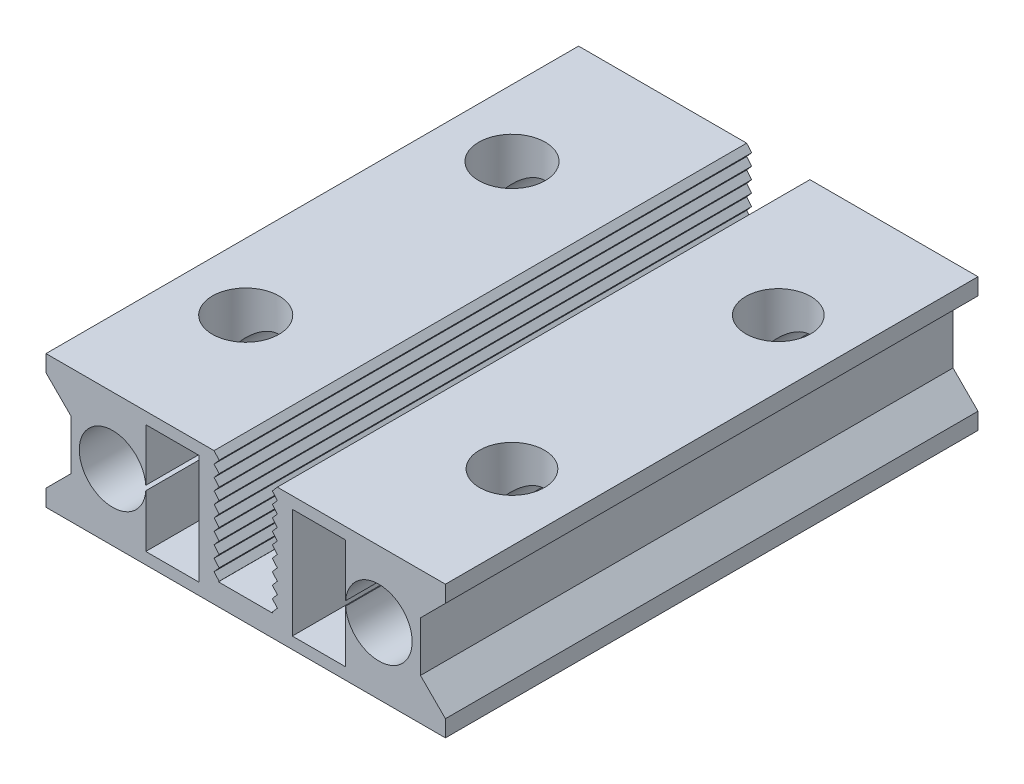
from build123d import *

# Parameters (mm, degrees)
EXTRUDE_2_DEPTH        = 32
EXTRUDE_3_DEPTH        = 32
PATTERN_LINEAR_1_COUNT = 10
PATTERN_LINEAR_1_PITCH = 0.7
MIRROR_1_COPY_1_DEPTH  = 32
MIRROR_1_COPY_2_DEPTH  = 32
MIRROR_1_COPY_3_DEPTH  = 32
MIRROR_1_COPY_4_DEPTH  = 32
MIRROR_1_COPY_5_DEPTH  = 32
MIRROR_1_COPY_6_DEPTH  = 32
MIRROR_1_COPY_7_DEPTH  = 32
MIRROR_1_COPY_8_DEPTH  = 32
MIRROR_1_COPY_9_DEPTH  = 32
SKETCH_4_R             = 2
SKETCH_4_R_2           = 1.95
CUT_EXTRUDE_1_DEPTH    = 36.09985755
PATTERN_LINEAR_2_COUNT = 2
PATTERN_LINEAR_2_PITCH = 16


with BuildPart() as part:
    # 草图1 → 凸台-拉伸2 (new body)
    with BuildSketch(Plane.XY):
        Polygon((-1.9, 8), (-12, 8), (-12, 7), (-10.5, 5.5), (-10.5, 2.5), (-12, 1), (-12, 0), (12, 0), (12, 1), (10.5, 2.5), (10.5, 5.5), (12, 7), (12, 8), (1.9, 8), (1.9, 1.3), (-1.9, 1.3), align=None)
        with BuildLine():
            Line((-6.005, 4.14133294), (-6.005, 7.3))
            Line((-6.005, 7.3), (-2.8, 7.3))
            Line((-2.8, 7.3), (-2.8, 0.7))
            Line((-2.8, 0.7), (-6.005, 0.7))
            Line((-6.005, 0.7), (-6.005, 3.85866706))
            ThreePointArc((-6.005, 3.85866706), (-10, 4), (-6.005, 4.14133294))
        make_face(mode=Mode.SUBTRACT)
        with BuildLine():
            Line((2.8, 0.7), (2.8, 7.3))
            Line((2.8, 7.3), (6.005, 7.3))
            Line((6.005, 7.3), (6.005, 4.14133294))
            ThreePointArc((6.005, 4.14133294), (10, 4), (6.005, 3.85866706))
            Line((6.005, 3.85866706), (6.005, 0.7))
            Line((6.005, 0.7), (2.8, 0.7))
        make_face(mode=Mode.SUBTRACT)
    extrude(amount=EXTRUDE_2_DEPTH)

    # 草图3 → 凸台-拉伸3 (add)
    with BuildSketch(Plane.XY.offset(32)):
        Polygon((-1.9, 8), (-1.6, 7.65), (-1.9, 7.3), align=None)
    extrude_3 = extrude(amount=-EXTRUDE_3_DEPTH)

    # 阵列(线性)1: 凸台-拉伸3 ×10
    with Locations(*[(0, -i * PATTERN_LINEAR_1_PITCH, 0) for i in range(1, PATTERN_LINEAR_1_COUNT)]):
        add(extrude_3)

    # 镜向1: 凸台-拉伸3 across plane
    add(extrude_3.mirror(Plane(origin=(0, 0, 0), x_dir=(0, 0, 1), z_dir=(1, 0, 0))))

    # 镜向1 copy 1 sketch → 镜向1 copy 1 (add)
    with BuildSketch(Plane(origin=(0, -0.7, 32), x_dir=(-1, 0, 0), z_dir=(0, 0, 1))):
        Polygon((-1.9, -8), (-1.6, -7.65), (-1.9, -7.3), align=None)
    extrude(amount=-MIRROR_1_COPY_1_DEPTH)

    # 镜向1 copy 2 sketch → 镜向1 copy 2 (add)
    with BuildSketch(Plane(origin=(0, -1.4, 32), x_dir=(-1, 0, 0), z_dir=(0, 0, 1))):
        Polygon((-1.9, -8), (-1.6, -7.65), (-1.9, -7.3), align=None)
    extrude(amount=-MIRROR_1_COPY_2_DEPTH)

    # 镜向1 copy 3 sketch → 镜向1 copy 3 (add)
    with BuildSketch(Plane(origin=(0, -2.1, 32), x_dir=(-1, 0, 0), z_dir=(0, 0, 1))):
        Polygon((-1.9, -8), (-1.6, -7.65), (-1.9, -7.3), align=None)
    extrude(amount=-MIRROR_1_COPY_3_DEPTH)

    # 镜向1 copy 4 sketch → 镜向1 copy 4 (add)
    with BuildSketch(Plane(origin=(0, -2.8, 32), x_dir=(-1, 0, 0), z_dir=(0, 0, 1))):
        Polygon((-1.9, -8), (-1.6, -7.65), (-1.9, -7.3), align=None)
    extrude(amount=-MIRROR_1_COPY_4_DEPTH)

    # 镜向1 copy 5 sketch → 镜向1 copy 5 (add)
    with BuildSketch(Plane(origin=(0, -3.5, 32), x_dir=(-1, 0, 0), z_dir=(0, 0, 1))):
        Polygon((-1.9, -8), (-1.6, -7.65), (-1.9, -7.3), align=None)
    extrude(amount=-MIRROR_1_COPY_5_DEPTH)

    # 镜向1 copy 6 sketch → 镜向1 copy 6 (add)
    with BuildSketch(Plane(origin=(0, -4.2, 32), x_dir=(-1, 0, 0), z_dir=(0, 0, 1))):
        Polygon((-1.9, -8), (-1.6, -7.65), (-1.9, -7.3), align=None)
    extrude(amount=-MIRROR_1_COPY_6_DEPTH)

    # 镜向1 copy 7 sketch → 镜向1 copy 7 (add)
    with BuildSketch(Plane(origin=(0, -4.9, 32), x_dir=(-1, 0, 0), z_dir=(0, 0, 1))):
        Polygon((-1.9, -8), (-1.6, -7.65), (-1.9, -7.3), align=None)
    extrude(amount=-MIRROR_1_COPY_7_DEPTH)

    # 镜向1 copy 8 sketch → 镜向1 copy 8 (add)
    with BuildSketch(Plane(origin=(0, -5.6, 32), x_dir=(-1, 0, 0), z_dir=(0, 0, 1))):
        Polygon((-1.9, -8), (-1.6, -7.65), (-1.9, -7.3), align=None)
    extrude(amount=-MIRROR_1_COPY_8_DEPTH)

    # 镜向1 copy 9 sketch → 镜向1 copy 9 (add)
    with BuildSketch(Plane(origin=(0, -6.3, 32), x_dir=(-1, 0, 0), z_dir=(0, 0, 1))):
        Polygon((-1.9, -8), (-1.6, -7.65), (-1.9, -7.3), align=None)
    extrude(amount=-MIRROR_1_COPY_9_DEPTH)

    # 草图4 → 切除-拉伸1 (cut, through all)
    with BuildSketch(Plane(origin=(0, 8, 0), x_dir=(1, 0, 0), z_dir=(0, 1, 0))):
        with Locations(Location((-8, -8, 0), (0, 0, 180))):
            Circle(SKETCH_4_R)
        with Locations(Location((8, -8, 0), (0, 0, 180))):
            Circle(SKETCH_4_R_2)
    cut_extrude_1 = extrude(amount=-CUT_EXTRUDE_1_DEPTH, mode=Mode.SUBTRACT)

    # 阵列(线性)2: 切除-拉伸1 ×2
    with Locations(*[(0, 0, i * PATTERN_LINEAR_2_PITCH) for i in range(1, PATTERN_LINEAR_2_COUNT)]):
        add(cut_extrude_1, mode=Mode.SUBTRACT)


solid = part.part
